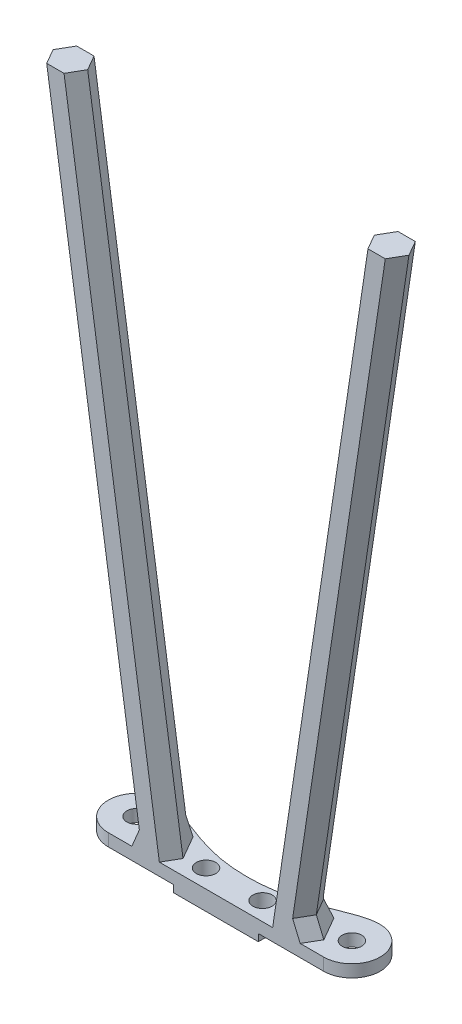
from build123d import *

# Parameters (mm, degrees)
SKETCH2_R                        = 1.375
BOSS_EXTRUDE1_DEPTH              = 1.75
CUT_EXTRUDE1_DEPTH               = 10
CHAMFER1_SIZE                    = 1.25
CHAMFER1_SIZE2                   = 3.434346774
CHAMFER1_EDGE_2_SIZE             = 1.25
CHAMFER1_EDGE_2_SIZE2            = 2.552275757
CHAMFER1_EDGE_3_SIZE             = 1.25
CHAMFER1_EDGE_3_SIZE2            = 2.552275757
CHAMFER1_OF_MIRROR1_SIZE2        = 3.434346774
CHAMFER1_OF_MIRROR1_SIZE         = 1.25
CHAMFER1_EDGE_2_OF_MIRROR1_SIZE2 = 2.552275757
CHAMFER1_EDGE_2_OF_MIRROR1_SIZE  = 1.25
CHAMFER1_EDGE_3_OF_MIRROR1_SIZE2 = 2.552275757
CHAMFER1_EDGE_3_OF_MIRROR1_SIZE  = 1.25
BOSS_EXTRUDE2_DEPTH              = 1
SKETCH8_R                        = 1.375
CUT_EXTRUDE2_DEPTH               = 102.267307157


with BuildPart() as part:
    # Sketch2 → Boss-Extrude1 (new body)
    with BuildSketch(Plane(origin=(0, 0, 0), x_dir=(1, 0, 0), z_dir=(0, 1, 0))):
        with BuildLine():
            Line((0, 4), (30.5, 4))
            ThreePointArc((30.5, 4), (34.5, 0), (30.5, -4))
            Line((30.5, -4), (0, -4))
            ThreePointArc((0, -4), (-4, 0), (0, 4))
        make_face()
        with Locations(Location((0, 0, 0), (0, 0, 270))):
            Circle(SKETCH2_R, mode=Mode.SUBTRACT)
        with Locations(Location((30.5, 0, 0), (0, 0, 270))):
            Circle(SKETCH2_R, mode=Mode.SUBTRACT)
    extrude(amount=BOSS_EXTRUDE1_DEPTH)

    # Sketch3 → Cut-Extrude1 (cut)
    with BuildSketch(Plane(origin=(0, 1.75, 0), x_dir=(1, 0, 0), z_dir=(0, 1, 0))):
        with BuildLine():
            Line((30.5, 4), (0, 4))
            add(Edge.make_bspline(
                [(0, 4), (1.392554105, 4), (4.712816119, 2.730302251), (11.200086309, 0.212313893), (19.274696625, 0.212313893), (25.842577961, 2.730302251), (29.028765437, 4), (30.5, 4)],
                knots=[0, 0, 0, 0, 0.131328662, 0.332777634, 0.667222366, 0.868671338, 1, 1, 1, 1], degree=3))
        make_face()
    extrude(amount=-CUT_EXTRUDE1_DEPTH, mode=Mode.SUBTRACT)

    # Sketch4 → Loft1 section 0
    with BuildSketch(Plane(origin=(0, 1.75, 0), x_dir=(1, 0, 0), z_dir=(0, 1, 0))):
        with BuildLine():
            Line((8.453738644, -1.875), (7.226869322, 0.25))
            Line((7.226869322, 0.25), (4.773130678, 0.25))
            Line((4.773130678, 0.25), (3.546261356, -1.875))
            Line((3.546261356, -1.875), (4.773130678, -4))
            Line((4.773130678, -4), (7.226869322, -4))
            Line((7.226869322, -4), (8.453738644, -1.875))
        make_face()
    # Sketch5 → Loft1 section 1
    with BuildSketch(Plane(origin=(0, 91.75, 0), x_dir=(1, 0, 0), z_dir=(0, 1, 0))):
        with BuildLine():
            Line((-5.046261356, -1.875), (-6.273130678, 0.25))
            Line((-6.273130678, 0.25), (-8.726869322, 0.25))
            Line((-8.726869322, 0.25), (-9.953738644, -1.875))
            Line((-9.953738644, -1.875), (-8.726869322, -4))
            Line((-8.726869322, -4), (-6.273130678, -4))
            Line((-6.273130678, -4), (-5.046261356, -1.875))
        make_face()
    loft1 = loft()

    # Chamfer1
    chamfer1_edges = [part.edges().sort_by_distance(p)[0] for p in [
        (6, 1.75, -0.25),
    ]]
    chamfer1_side = [part.faces().sort_by_distance(p)[0] for p in [
        (15.962582186, 1.75, 0.665337448),
    ]]
    chamfer(chamfer1_edges, length=CHAMFER1_SIZE, length2=CHAMFER1_SIZE2, reference=chamfer1_side[0])

    # Chamfer1 edge 2
    chamfer1_edge_2_edges = [part.edges().sort_by_distance(p)[0] for p in [
        (4.159696017, 1.75, 0.8125),
    ]]
    chamfer1_edge_2_side = [part.faces().sort_by_distance(p)[0] for p in [
        (15.962582186, 1.75, 0.665337448),
    ]]
    chamfer(chamfer1_edge_2_edges, length=CHAMFER1_EDGE_2_SIZE, length2=CHAMFER1_EDGE_2_SIZE2, reference=chamfer1_edge_2_side[0])

    # Chamfer1 edge 3
    chamfer1_edge_3_edges = [part.edges().sort_by_distance(p)[0] for p in [
        (4.159696017, 1.75, 2.9375),
    ]]
    chamfer1_edge_3_side = [part.faces().sort_by_distance(p)[0] for p in [
        (15.962582186, 1.75, 0.665337448),
    ]]
    chamfer(chamfer1_edge_3_edges, length=CHAMFER1_EDGE_3_SIZE, length2=CHAMFER1_EDGE_3_SIZE2, reference=chamfer1_edge_3_side[0])

    # Mirror1: Loft1 across plane
    add(loft1.mirror(Plane(origin=(15.25, 0, 0), x_dir=(0, 0, 1), z_dir=(1, 0, 0))))

    # Chamfer1 of Mirror1
    chamfer1_of_mirror1_edges = [part.edges().sort_by_distance(p)[0] for p in [
        (24.5, 1.75, -0.25),
    ]]
    chamfer(chamfer1_of_mirror1_edges, length=CHAMFER1_OF_MIRROR1_SIZE, length2=CHAMFER1_OF_MIRROR1_SIZE2)

    # Chamfer1 edge 2 of Mirror1
    chamfer1_edge_2_of_mirror1_edges = [part.edges().sort_by_distance(p)[0] for p in [
        (26.340303983, 1.75, 0.8125),
    ]]
    chamfer(chamfer1_edge_2_of_mirror1_edges, length=CHAMFER1_EDGE_2_OF_MIRROR1_SIZE, length2=CHAMFER1_EDGE_2_OF_MIRROR1_SIZE2)

    # Chamfer1 edge 3 of Mirror1
    chamfer1_edge_3_of_mirror1_edges = [part.edges().sort_by_distance(p)[0] for p in [
        (26.340303983, 1.75, 2.9375),
    ]]
    chamfer(chamfer1_edge_3_of_mirror1_edges, length=CHAMFER1_EDGE_3_OF_MIRROR1_SIZE, length2=CHAMFER1_EDGE_3_OF_MIRROR1_SIZE2)

    # Sketch6 → Boss-Extrude2 (add)
    with BuildSketch(Plane.XZ):
        with BuildLine():
            Line((9.25, 4), (9.25, -1.186704991))
            add(Edge.make_bspline(
                [(9.25, -1.186704991), (9.498756449, -1.120525729), (13.135912237, -0.212313893), (17.336765902, -0.212313893), (21.001177664, -1.119553839), (21.25, -1.185159308)],
                knots=[0.308100917, 0.308100917, 0.308100917, 0.308100917, 0.332777634, 0.667222366, 0.691706881, 0.691706881, 0.691706881, 0.691706881], degree=3))
            Line((21.25, -1.185159308), (21.25, 4))
            Line((21.25, 4), (9.25, 4))
        make_face()
    extrude(amount=BOSS_EXTRUDE2_DEPTH)

    # Sketch8 → Cut-Extrude2 (cut, through all)
    with BuildSketch(Plane.XZ.offset(1)):
        with Locations(Location((11.249999996, 1.406776311, 0), (0, 0, 270))):
            Circle(SKETCH8_R)
        with Locations(Location((19.250000004, 1.407291539, 0), (0, 0, 270))):
            Circle(SKETCH8_R)
    extrude(amount=-CUT_EXTRUDE2_DEPTH, mode=Mode.SUBTRACT)


solid = part.part
